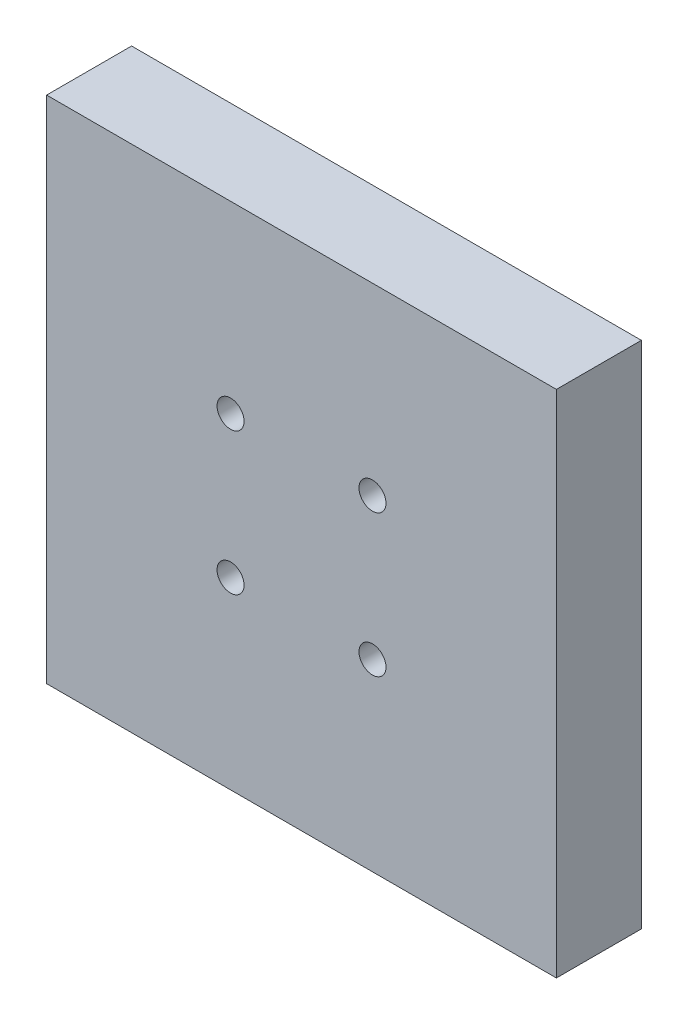
from build123d import *

# Parameters (mm, degrees)
BOSS_EXTRUDE1_DEPTH = 12.7
SKETCH2_R           = 2.0193
CUT_EXTRUDE1_DEPTH  = 56.358016583


with BuildPart() as part:
    # Sketch1 → Boss-Extrude1 (new body)
    with BuildSketch(Plane.XY):
        Polygon((-38.1, 38.1), (-38.1, -38.1), (-12.7, -38.1), (12.7, -38.1), (38.1, -38.1), (38.1, 38.1), (12.7, 38.1), (-12.7, 38.1), align=None)
    extrude(amount=BOSS_EXTRUDE1_DEPTH)

    # Sketch2 → Cut-Extrude1 (cut, through all)
    with BuildSketch(Plane.XY.offset(12.7)):
        with Locations((10.606601718, 10.606601718)):
            Circle(SKETCH2_R)
        with Locations(Location((10.606601718, -10.606601718, 0), (0, 0, 180))):
            Circle(SKETCH2_R)
        with Locations((-10.606601718, -10.606601718)):
            Circle(SKETCH2_R)
        with Locations(Location((-10.606601718, 10.606601718, 0), (0, 0, 180))):
            Circle(SKETCH2_R)
    extrude(amount=-CUT_EXTRUDE1_DEPTH, mode=Mode.SUBTRACT)


solid = part.part
